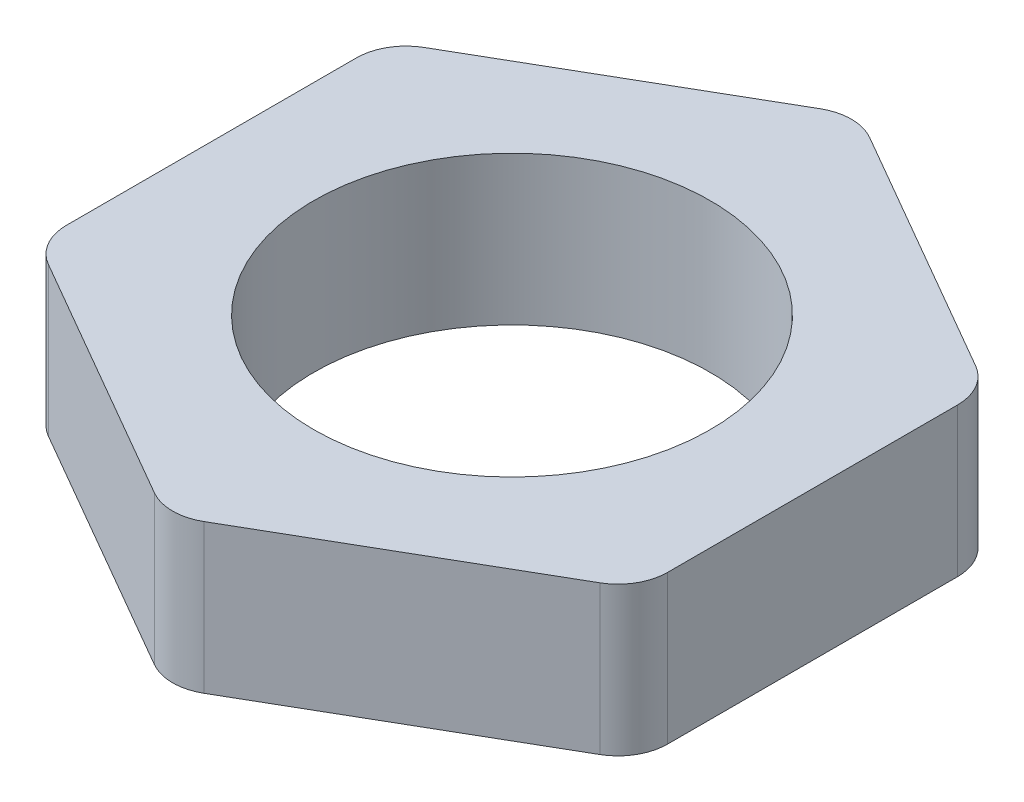
from build123d import *

# Parameters (mm, degrees)
SKETCH1_R           = 4
BOSS_EXTRUDE1_DEPTH = 1.5


with BuildPart() as part:
    # Sketch1 → Boss-Extrude1 (new, symmetric)
    with BuildSketch(Plane(origin=(0, 0, 0), x_dir=(1, 0, 0), z_dir=(0, 1, 0))):
        with BuildLine():
            Line((5.562177826, 3.788675135), (0.5, 6.711324865))
            ThreePointArc((0.5, 6.711324865), (0, 6.845299462), (-0.5, 6.711324865))
            Line((-0.5, 6.711324865), (-5.562177826, 3.788675135))
            ThreePointArc((-5.562177826, 3.788675135), (-5.92820323, 3.422649731), (-6.062177826, 2.922649731))
            Line((-6.062177826, 2.922649731), (-6.062177826, -2.922649731))
            ThreePointArc((-6.062177826, -2.922649731), (-5.92820323, -3.422649731), (-5.562177826, -3.788675135))
            Line((-5.562177826, -3.788675135), (-0.5, -6.711324865))
            ThreePointArc((-0.5, -6.711324865), (0, -6.845299462), (0.5, -6.711324865))
            Line((0.5, -6.711324865), (5.562177826, -3.788675135))
            ThreePointArc((5.562177826, -3.788675135), (5.92820323, -3.422649731), (6.062177826, -2.922649731))
            Line((6.062177826, -2.922649731), (6.062177826, 2.922649731))
            ThreePointArc((6.062177826, 2.922649731), (5.92820323, 3.422649731), (5.562177826, 3.788675135))
        make_face()
        with Locations(Location((0, 0, 0), (0, 0, 270))):
            Circle(SKETCH1_R, mode=Mode.SUBTRACT)
    extrude(amount=BOSS_EXTRUDE1_DEPTH, both=True)


solid = part.part
